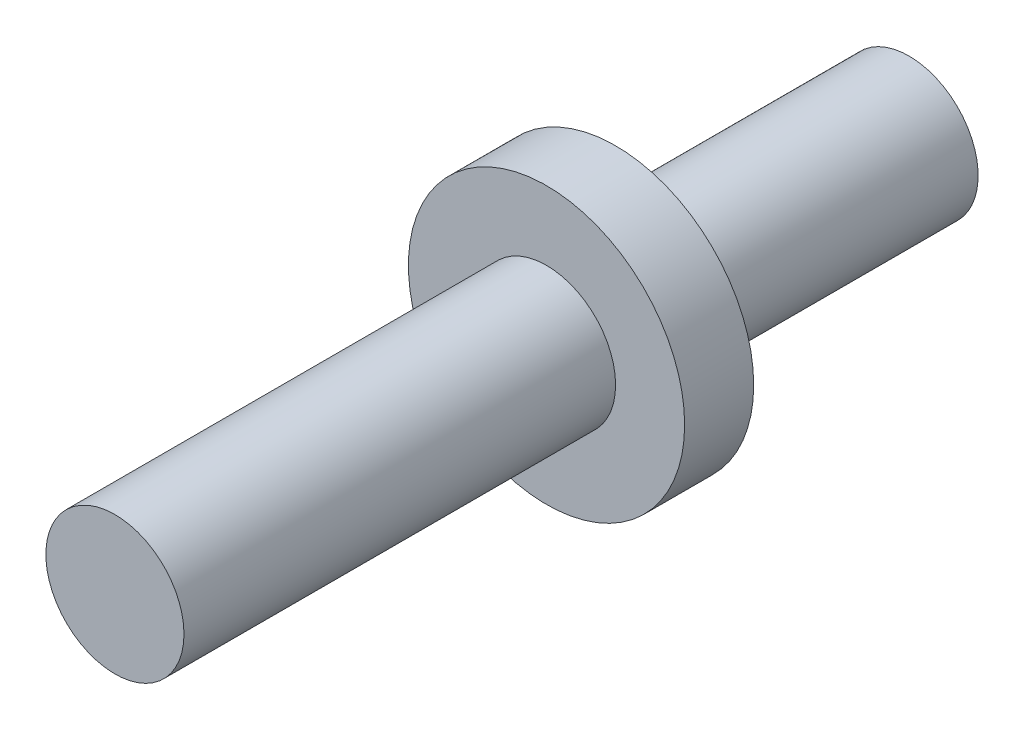
from build123d import *

# Parameters (mm, degrees)
ESQUISSE1_R          = 16
BASE_EXTRUSION_DEPTH = 8
ESQUISSE2_R          = 8
BOSS_EXTRU_1_DEPTH   = 50
BOSS_EXTRU_2_START   = 34
ESQUISSE3_R          = 8
BOSS_EXTRU_2_DEPTH   = 34


with BuildPart() as part:
    # Esquisse1 → Base-Extrusion (new body)
    with BuildSketch(Plane.XY):
        Circle(ESQUISSE1_R)
    extrude(amount=BASE_EXTRUSION_DEPTH)

    # Esquisse2 → Boss.-Extru.1 (add)
    with BuildSketch(Plane.XY.offset(8)):
        Circle(ESQUISSE2_R)
    extrude(amount=BOSS_EXTRU_1_DEPTH)

    # Esquisse3 → Boss.-Extru.2 (add)
    with BuildSketch(Plane(origin=(0, 0, 0), x_dir=(-1, 0, 0), z_dir=(0, 0, -1)).offset(BOSS_EXTRU_2_START)):
        with Locations(Location((0, 0, 0), (0, 0, 180))):
            Circle(ESQUISSE3_R)
    extrude(amount=-BOSS_EXTRU_2_DEPTH)


solid = part.part
